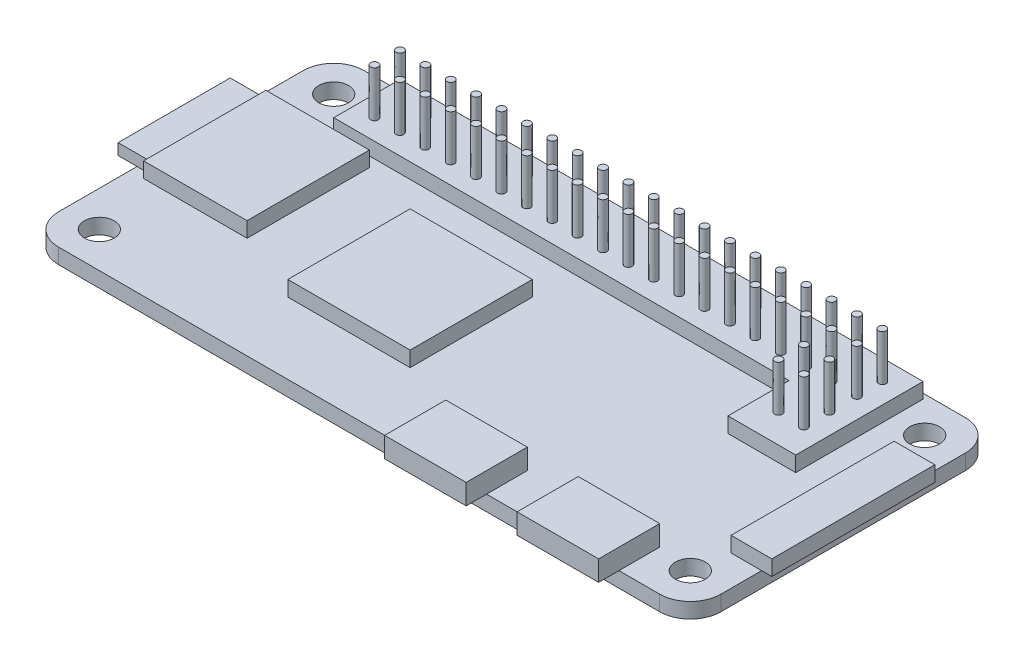
from build123d import *

# Parameters (mm, degrees)
BOSS_EXTRUDE1_DEPTH = 1.5
CUT_EXTRUDE1_REACH  = 37.826
SKETCH2_R           = 1.467442469
SKETCH3_W           = 10.157602887
SKETCH3_H           = 12
SKETCH3_W_2         = 4
SKETCH3_H_2         = 16
SKETCH3_W_3         = 12
BOSS_EXTRUDE2_DEPTH = 1.5
SKETCH5_R           = 0.375
BOSS_EXTRUDE3_DEPTH = 4.5
SKETCH6_W           = 11
SKETCH6_H           = 1.1
BOSS_EXTRUDE4_DEPTH = 3
CUT_EXTRUDE3_START  = -1.5
SKETCH8_R           = 0.375
CUT_EXTRUDE3_DEPTH  = 1.5
SKETCH9_W           = 8
SKETCH9_H           = 6
BOSS_EXTRUDE5_DEPTH = 2
LPATTERN1_COUNT     = 2
LPATTERN1_PITCH     = 13


with BuildPart() as part:
    # Sketch1 → Boss-Extrude1 (new body)
    with BuildSketch(Plane(origin=(0, 0, 0), x_dir=(1, 0, 0), z_dir=(0, 1, 0))):
        with BuildLine():
            Line((-29.5, 15), (29.5, 15))
            ThreePointArc((29.5, 15), (31.621320344, 14.121320344), (32.5, 12))
            Line((32.5, 12), (32.5, -12))
            ThreePointArc((32.5, -12), (31.621320344, -14.121320344), (29.5, -15))
            Line((29.5, -15), (-29.5, -15))
            ThreePointArc((-29.5, -15), (-31.621320344, -14.121320344), (-32.5, -12))
            Line((-32.5, -12), (-32.5, 12))
            ThreePointArc((-32.5, 12), (-31.621320344, 14.121320344), (-29.5, 15))
        make_face()
    extrude(amount=BOSS_EXTRUDE1_DEPTH)

    # Sketch2 → Cut-Extrude1 (cut, up to next)
    with BuildSketch(Plane(origin=(0, 1.5, 0), x_dir=(1, 0, 0), z_dir=(0, 1, 0)), mode=Mode.PRIVATE) as cut_extrude1_sk1:
        with Locations(Location((-29, 11.5, 0), (0, 0, 270))):
            Circle(SKETCH2_R)
    cut_extrude1_tool1 = extrude(cut_extrude1_sk1.sketch, amount=-CUT_EXTRUDE1_REACH, mode=Mode.PRIVATE) & part.part
    # Sketch2 → Cut-Extrude1 (cut, up to next)
    with BuildSketch(Plane(origin=(0, 1.5, 0), x_dir=(1, 0, 0), z_dir=(0, 1, 0)), mode=Mode.PRIVATE) as cut_extrude1_sk2:
        with Locations(Location((29, 11.5, 0), (0, 0, 90))):
            Circle(SKETCH2_R)
    cut_extrude1_tool2 = extrude(cut_extrude1_sk2.sketch, amount=-CUT_EXTRUDE1_REACH, mode=Mode.PRIVATE) & part.part
    # Sketch2 → Cut-Extrude1 (cut, up to next)
    with BuildSketch(Plane(origin=(0, 1.5, 0), x_dir=(1, 0, 0), z_dir=(0, 1, 0)), mode=Mode.PRIVATE) as cut_extrude1_sk3:
        with Locations(Location((29, -11.5, 0), (0, 0, 270))):
            Circle(SKETCH2_R)
    cut_extrude1_tool3 = extrude(cut_extrude1_sk3.sketch, amount=-CUT_EXTRUDE1_REACH, mode=Mode.PRIVATE) & part.part
    # Sketch2 → Cut-Extrude1 (cut, up to next)
    with BuildSketch(Plane(origin=(0, 1.5, 0), x_dir=(1, 0, 0), z_dir=(0, 1, 0)), mode=Mode.PRIVATE) as cut_extrude1_sk4:
        with Locations(Location((-29, -11.5, 0), (0, 0, 90))):
            Circle(SKETCH2_R)
    cut_extrude1_tool4 = extrude(cut_extrude1_sk4.sketch, amount=-CUT_EXTRUDE1_REACH, mode=Mode.PRIVATE) & part.part
    add(cut_extrude1_tool1.solids().sort_by_distance((-29, 1.5, -11.5))[0], mode=Mode.SUBTRACT)
    add(cut_extrude1_tool2.solids().sort_by_distance((29, 1.5, -11.5))[0], mode=Mode.SUBTRACT)
    add(cut_extrude1_tool3.solids().sort_by_distance((29, 1.5, 11.5))[0], mode=Mode.SUBTRACT)
    add(cut_extrude1_tool4.solids().sort_by_distance((-29, 1.5, 11.5))[0], mode=Mode.SUBTRACT)

    # Sketch3 → Boss-Extrude2 (add)
    with BuildSketch(Plane(origin=(0, 1.5, 0), x_dir=(1, 0, 0), z_dir=(0, 1, 0))):
        with Locations((-26.07840907, 1)):
            Rectangle(SKETCH3_W, SKETCH3_H)
        Polygon((-25.49474736, 14.5), (25.845826925, 14.5), (25.845826925, 8), (25.845826925, 2), (19.195826925, 2), (19.195826925, 8), (-25.49474736, 8), align=None)
        with Locations((31.5, 0)):
            Rectangle(SKETCH3_W_2, SKETCH3_H_2)
        with Locations((-7.999607626, -2)):
            Rectangle(SKETCH3_W_3, SKETCH3_H)
    extrude(amount=BOSS_EXTRUDE2_DEPTH)

    # Sketch5 → Boss-Extrude3 (add)
    with BuildSketch(Plane(origin=(0, 3, 0), x_dir=(1, 0, 0), z_dir=(0, 1, 0))):
        with Locations(Location((-23.49474736, 12.5, 0), (0, 0, 270))):
            Circle(SKETCH5_R)
        with Locations(Location((-21.003138187, 12.5, 0), (0, 0, 270))):
            Circle(SKETCH5_R)
        with Locations(Location((-18.511529014, 12.5, 0), (0, 0, 270))):
            Circle(SKETCH5_R)
        with Locations(Location((-16.019919842, 12.5, 0), (0, 0, 270))):
            Circle(SKETCH5_R)
        with Locations(Location((-13.528310669, 12.5, 0), (0, 0, 270))):
            Circle(SKETCH5_R)
        with Locations(Location((-11.036701496, 12.5, 0), (0, 0, 270))):
            Circle(SKETCH5_R)
        with Locations(Location((-8.545092323, 12.5, 0), (0, 0, 270))):
            Circle(SKETCH5_R)
        with Locations(Location((-6.05348315, 12.5, 0), (0, 0, 270))):
            Circle(SKETCH5_R)
        with Locations(Location((-3.561873977, 12.5, 0), (0, 0, 270))):
            Circle(SKETCH5_R)
        with Locations(Location((-1.070264804, 12.5, 0), (0, 0, 270))):
            Circle(SKETCH5_R)
        with Locations(Location((1.421344369, 12.5, 0), (0, 0, 270))):
            Circle(SKETCH5_R)
        with Locations(Location((3.912953542, 12.5, 0), (0, 0, 270))):
            Circle(SKETCH5_R)
        with Locations(Location((6.404562715, 12.5, 0), (0, 0, 270))):
            Circle(SKETCH5_R)
        with Locations(Location((8.896171887, 12.5, 0), (0, 0, 270))):
            Circle(SKETCH5_R)
        with Locations(Location((11.38778106, 12.5, 0), (0, 0, 270))):
            Circle(SKETCH5_R)
        with Locations(Location((13.879390233, 12.5, 0), (0, 0, 270))):
            Circle(SKETCH5_R)
        with Locations(Location((16.370999406, 12.5, 0), (0, 0, 270))):
            Circle(SKETCH5_R)
        with Locations(Location((18.862608579, 12.5, 0), (0, 0, 270))):
            Circle(SKETCH5_R)
        with Locations(Location((21.354217752, 12.5, 0), (0, 0, 270))):
            Circle(SKETCH5_R)
        with Locations(Location((23.845826925, 12.5, 0), (0, 0, 270))):
            Circle(SKETCH5_R)
        with Locations(Location((-21.003138187, 10, 0), (0, 0, 270))):
            Circle(SKETCH5_R)
        with Locations(Location((-18.511529014, 10, 0), (0, 0, 270))):
            Circle(SKETCH5_R)
        with Locations(Location((-16.019919842, 10, 0), (0, 0, 270))):
            Circle(SKETCH5_R)
        with Locations(Location((-13.528310669, 10, 0), (0, 0, 270))):
            Circle(SKETCH5_R)
        with Locations(Location((-11.036701496, 10, 0), (0, 0, 270))):
            Circle(SKETCH5_R)
        with Locations(Location((-8.545092323, 10, 0), (0, 0, 270))):
            Circle(SKETCH5_R)
        with Locations(Location((-6.05348315, 10, 0), (0, 0, 270))):
            Circle(SKETCH5_R)
        with Locations(Location((-3.561873977, 10, 0), (0, 0, 270))):
            Circle(SKETCH5_R)
        with Locations(Location((-1.070264804, 10, 0), (0, 0, 270))):
            Circle(SKETCH5_R)
        with Locations(Location((1.421344369, 10, 0), (0, 0, 270))):
            Circle(SKETCH5_R)
        with Locations(Location((3.912953542, 10, 0), (0, 0, 270))):
            Circle(SKETCH5_R)
        with Locations(Location((6.404562715, 10, 0), (0, 0, 270))):
            Circle(SKETCH5_R)
        with Locations(Location((8.896171887, 10, 0), (0, 0, 270))):
            Circle(SKETCH5_R)
        with Locations(Location((11.38778106, 10, 0), (0, 0, 270))):
            Circle(SKETCH5_R)
        with Locations(Location((13.879390233, 10, 0), (0, 0, 270))):
            Circle(SKETCH5_R)
        with Locations(Location((16.370999406, 10, 0), (0, 0, 270))):
            Circle(SKETCH5_R)
        with Locations(Location((18.862608579, 10, 0), (0, 0, 270))):
            Circle(SKETCH5_R)
        with Locations(Location((21.354217752, 10, 0), (0, 0, 270))):
            Circle(SKETCH5_R)
        with Locations(Location((23.845826925, 10, 0), (0, 0, 270))):
            Circle(SKETCH5_R)
        with Locations(Location((-23.49474736, 10, 0), (0, 0, 270))):
            Circle(SKETCH5_R)
        with Locations(Location((21.354217752, 4.8, 0), (0, 0, 270))):
            Circle(SKETCH5_R)
        with Locations(Location((21.354217752, 7.3, 0), (0, 0, 270))):
            Circle(SKETCH5_R)
        with Locations(Location((23.845826925, 7.3, 0), (0, 0, 270))):
            Circle(SKETCH5_R)
        with Locations(Location((23.845826925, 4.8, 0), (0, 0, 270))):
            Circle(SKETCH5_R)
    extrude(amount=BOSS_EXTRUDE3_DEPTH)

    # Sketch6 → Boss-Extrude4 (add)
    with BuildSketch(Plane.ZY.offset(31.157210513)):
        with Locations((-1, 2.25)):
            Rectangle(SKETCH6_W, SKETCH6_H)
    extrude(amount=BOSS_EXTRUDE4_DEPTH)

    # Sketch8 → Cut-Extrude3 (cut)
    with BuildSketch(Plane(origin=(0, 1.5, 0), x_dir=(1, 0, 0), z_dir=(0, 1, 0)).offset(CUT_EXTRUDE3_START)):
        with Locations(Location((-11.036701496, 12.5, 0), (0, 0, 270))):
            Circle(SKETCH8_R)
        with Locations(Location((-13.528310669, 12.5, 0), (0, 0, 270))):
            Circle(SKETCH8_R)
        with Locations(Location((-16.019919842, 12.5, 0), (0, 0, 270))):
            Circle(SKETCH8_R)
        with Locations(Location((-18.511529014, 12.5, 0), (0, 0, 270))):
            Circle(SKETCH8_R)
        with Locations(Location((-21.003138187, 12.5, 0), (0, 0, 270))):
            Circle(SKETCH8_R)
        with Locations(Location((-23.49474736, 12.5, 0), (0, 0, 270))):
            Circle(SKETCH8_R)
        with Locations(Location((8.896171887, 12.5, 0), (0, 0, 270))):
            Circle(SKETCH8_R)
        with Locations(Location((6.404562715, 12.5, 0), (0, 0, 270))):
            Circle(SKETCH8_R)
        with Locations(Location((3.912953542, 12.5, 0), (0, 0, 270))):
            Circle(SKETCH8_R)
        with Locations(Location((1.421344369, 12.5, 0), (0, 0, 270))):
            Circle(SKETCH8_R)
        with Locations(Location((-1.070264804, 12.5, 0), (0, 0, 270))):
            Circle(SKETCH8_R)
        with Locations(Location((-3.561873977, 12.5, 0), (0, 0, 270))):
            Circle(SKETCH8_R)
        with Locations(Location((-6.05348315, 12.5, 0), (0, 0, 270))):
            Circle(SKETCH8_R)
        with Locations(Location((-8.545092323, 12.5, 0), (0, 0, 270))):
            Circle(SKETCH8_R)
        with Locations(Location((-18.511529014, 10, 0), (0, 0, 270))):
            Circle(SKETCH8_R)
        with Locations(Location((-21.003138187, 10, 0), (0, 0, 270))):
            Circle(SKETCH8_R)
        with Locations(Location((23.845826925, 12.5, 0), (0, 0, 270))):
            Circle(SKETCH8_R)
        with Locations(Location((21.354217752, 12.5, 0), (0, 0, 270))):
            Circle(SKETCH8_R)
        with Locations(Location((18.862608579, 12.5, 0), (0, 0, 270))):
            Circle(SKETCH8_R)
        with Locations(Location((16.370999406, 12.5, 0), (0, 0, 270))):
            Circle(SKETCH8_R)
        with Locations(Location((13.879390233, 12.5, 0), (0, 0, 270))):
            Circle(SKETCH8_R)
        with Locations(Location((11.38778106, 12.5, 0), (0, 0, 270))):
            Circle(SKETCH8_R)
        with Locations(Location((1.421344369, 10, 0), (0, 0, 270))):
            Circle(SKETCH8_R)
        with Locations(Location((-1.070264804, 10, 0), (0, 0, 270))):
            Circle(SKETCH8_R)
        with Locations(Location((-3.561873977, 10, 0), (0, 0, 270))):
            Circle(SKETCH8_R)
        with Locations(Location((-6.05348315, 10, 0), (0, 0, 270))):
            Circle(SKETCH8_R)
        with Locations(Location((-8.545092323, 10, 0), (0, 0, 270))):
            Circle(SKETCH8_R)
        with Locations(Location((-11.036701496, 10, 0), (0, 0, 270))):
            Circle(SKETCH8_R)
        with Locations(Location((-13.528310669, 10, 0), (0, 0, 270))):
            Circle(SKETCH8_R)
        with Locations(Location((-16.019919842, 10, 0), (0, 0, 270))):
            Circle(SKETCH8_R)
        with Locations(Location((21.354217752, 10, 0), (0, 0, 270))):
            Circle(SKETCH8_R)
        with Locations(Location((18.862608579, 10, 0), (0, 0, 270))):
            Circle(SKETCH8_R)
        with Locations(Location((16.370999406, 10, 0), (0, 0, 270))):
            Circle(SKETCH8_R)
        with Locations(Location((13.879390233, 10, 0), (0, 0, 270))):
            Circle(SKETCH8_R)
        with Locations(Location((11.38778106, 10, 0), (0, 0, 270))):
            Circle(SKETCH8_R)
        with Locations(Location((8.896171887, 10, 0), (0, 0, 270))):
            Circle(SKETCH8_R)
        with Locations(Location((6.404562715, 10, 0), (0, 0, 270))):
            Circle(SKETCH8_R)
        with Locations(Location((3.912953542, 10, 0), (0, 0, 270))):
            Circle(SKETCH8_R)
        with Locations(Location((-23.49474736, 10, 0), (0, 0, 270))):
            Circle(SKETCH8_R)
        with Locations(Location((23.845826925, 10, 0), (0, 0, 270))):
            Circle(SKETCH8_R)
        with Locations(Location((23.845826925, 4.8, 0), (0, 0, 270))):
            Circle(SKETCH8_R)
        with Locations(Location((21.354217752, 4.8, 0), (0, 0, 270))):
            Circle(SKETCH8_R)
        with Locations(Location((21.354217752, 7.3, 0), (0, 0, 270))):
            Circle(SKETCH8_R)
        with Locations(Location((23.845826925, 7.3, 0), (0, 0, 270))):
            Circle(SKETCH8_R)
    extrude(amount=CUT_EXTRUDE3_DEPTH, mode=Mode.SUBTRACT)

    # Sketch9 → Boss-Extrude5 (add)
    with BuildSketch(Plane(origin=(0, 1.5, 0), x_dir=(1, 0, 0), z_dir=(0, 1, 0))):
        with Locations((21.5, -14)):
            Rectangle(SKETCH9_W, SKETCH9_H)
    boss_extrude5 = extrude(amount=BOSS_EXTRUDE5_DEPTH)

    # LPattern1: Boss-Extrude5 ×2
    with Locations(*[(-i * LPATTERN1_PITCH, 0, 0) for i in range(1, LPATTERN1_COUNT)]):
        add(boss_extrude5)


solid = part.part
